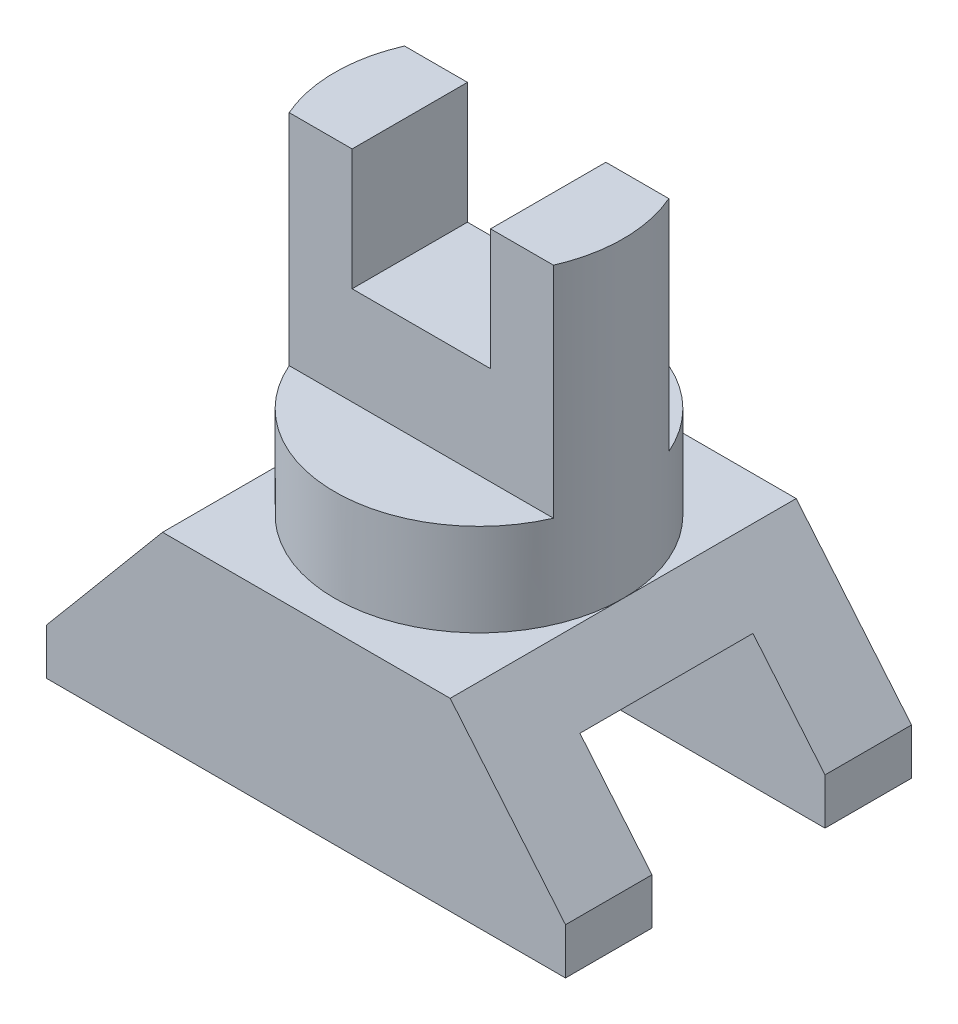
from build123d import *

# Parameters (mm, degrees)
SKETCH4_W            = 90
SKETCH4_H            = 60
BOSS_EXTRUDE13_DEPTH = 32
BOSS_EXTRUDE14_DEPTH = 54
SKETCH4_30_W         = 24
SKETCH4_30_H         = 20
BOSS_EXTRUDE16_DEPTH = 33
BOSS_EXTRUDE17_DEPTH = 16
SKETCH5_W            = 30
SKETCH5_H            = 23
CUT_EXTRUDE2_DEPTH   = 100
CUT_EXTRUDE3_DEPTH   = 100
CUT_EXTRUDE6_DEPTH   = 100


with BuildPart() as part:
    # Sketch4 → Boss-Extrude13 (new body)
    with BuildSketch(Plane(origin=(0, 0, 0), x_dir=(1, 0, 0), z_dir=(0, 1, 0))):
        with Locations((-31.3432161, 7.554270448)):
            Rectangle(SKETCH4_W, SKETCH4_H)
    extrude(amount=-BOSS_EXTRUDE13_DEPTH)

    # Sketch4<27> → Boss-Extrude14 (add)
    with BuildSketch(Plane(origin=(0, 0, 0), x_dir=(1, 0, 0), z_dir=(0, 1, 0))):
        with BuildLine():
            ThreePointArc((-54.256094575, 17.554270448), (-56.3432161, 7.554270448), (-54.256094575, -2.445729552))
            Line((-54.256094575, -2.445729552), (-43.3432161, -2.445729552))
            Line((-43.3432161, -2.445729552), (-43.3432161, 17.554270448))
            Line((-43.3432161, 17.554270448), (-54.256094575, 17.554270448))
        make_face()
        with BuildLine():
            ThreePointArc((-8.430337625, -2.445729552), (-6.3432161, 7.554270448), (-8.430337625, 17.554270448))
            Line((-8.430337625, 17.554270448), (-19.3432161, 17.554270448))
            Line((-19.3432161, 17.554270448), (-19.3432161, -2.445729552))
            Line((-19.3432161, -2.445729552), (-8.430337625, -2.445729552))
        make_face()
    extrude(amount=BOSS_EXTRUDE14_DEPTH)

    # Sketch4<30> → Boss-Extrude16 (add)
    with BuildSketch(Plane(origin=(0, 0, 0), x_dir=(1, 0, 0), z_dir=(0, 1, 0))):
        with Locations((-31.3432161, 7.554270448)):
            Rectangle(SKETCH4_30_W, SKETCH4_30_H)
    extrude(amount=BOSS_EXTRUDE16_DEPTH)

    # Sketch4<31> → Boss-Extrude17 (add)
    with BuildSketch(Plane(origin=(0, 0, 0), x_dir=(1, 0, 0), z_dir=(0, 1, 0))):
        with BuildLine():
            ThreePointArc((-8.430337625, 17.554270448), (-31.3432161, 32.554270448), (-54.256094575, 17.554270448))
            Line((-54.256094575, 17.554270448), (-8.430337625, 17.554270448))
        make_face()
        with BuildLine():
            Line((-8.430337625, -2.445729552), (-54.256094575, -2.445729552))
            ThreePointArc((-54.256094575, -2.445729552), (-31.3432161, -17.445729552), (-8.430337625, -2.445729552))
        make_face()
    extrude(amount=BOSS_EXTRUDE17_DEPTH)

    # Sketch5 → Cut-Extrude2 (cut)
    with BuildSketch(Plane.ZY.offset(76.3432161)):
        with Locations((-7.554270448, -20.5)):
            Rectangle(SKETCH5_W, SKETCH5_H)
    extrude(amount=-CUT_EXTRUDE2_DEPTH, mode=Mode.SUBTRACT)

    # Sketch7 → Cut-Extrude3 (cut)
    with BuildSketch(Plane.XY):
        Polygon((-76.3432161, 0), (-76.3432161, -24), (-56.214551836, 0), align=None)
        Polygon((-6.3432161, 0), (13.6567839, -24), (13.6567839, 0), align=None)
    extrude(amount=-CUT_EXTRUDE3_DEPTH, mode=Mode.SUBTRACT)

    # Sketch7<4> → Cut-Extrude6 (cut)
    with BuildSketch(Plane.XY):
        Polygon((-76.3432161, 0), (-76.3432161, -24), (-56.214551836, 0), align=None)
        Polygon((-6.3432161, 0), (13.6567839, -24), (13.6567839, 0), align=None)
    extrude(amount=CUT_EXTRUDE6_DEPTH, mode=Mode.SUBTRACT)


solid = part.part
